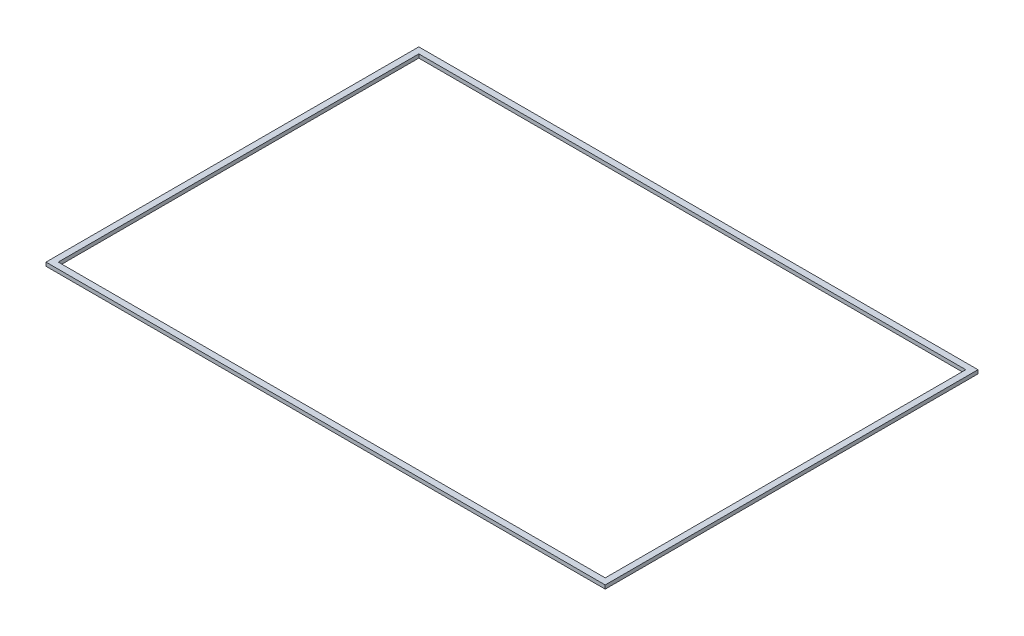
from build123d import *

# Parameters (mm, degrees)
SKETCH_1_W      = 20
SKETCH_1_H      = 600
EXTRUDE_1_DEPTH = 12


with BuildPart() as part:
    # Эскиз1 → Выдавливание1 (new body)
    with BuildSketch(Plane(origin=(0, 0, 0), x_dir=(-1, 0, 0), z_dir=(0, 1, 0))):
        Polygon((-915, -300), (-915, -610), (915, -610), (915, -300), (895, -300), (895, -590), (-895, -590), (-895, -300), align=None)
        Polygon((-895, 300), (-895, 590), (895, 590), (895, 300), (915, 300), (915, 610), (-915, 610), (-915, 300), align=None)
        with Locations((-905, 0)):
            Rectangle(SKETCH_1_W, SKETCH_1_H)
        with Locations((905, 0)):
            Rectangle(SKETCH_1_W, SKETCH_1_H)
    extrude(amount=EXTRUDE_1_DEPTH)


solid = part.part
